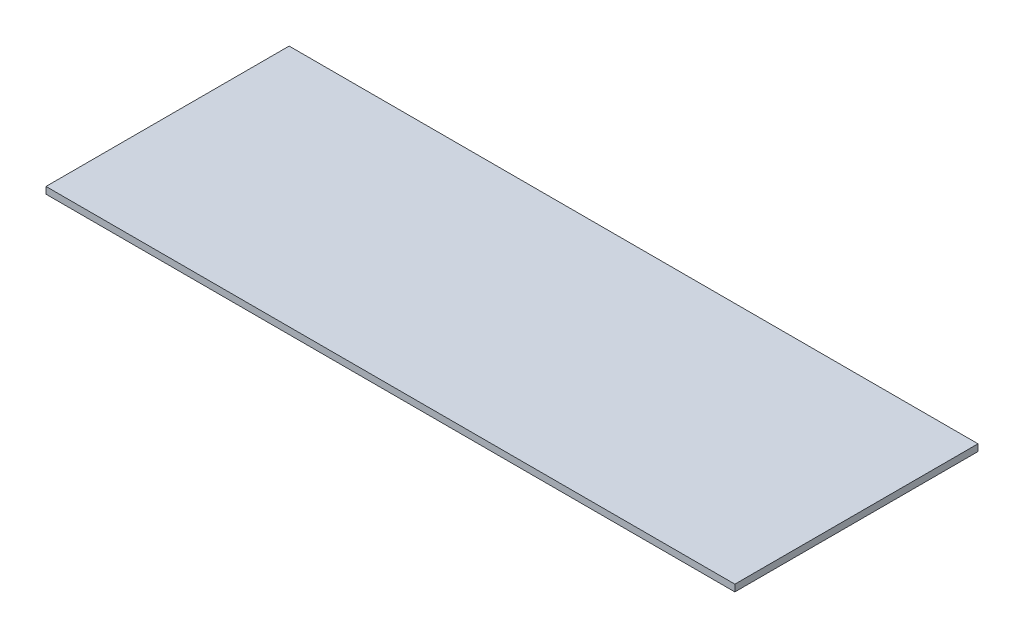
from build123d import *

# Parameters (mm, degrees)
SKETCH1_W           = 647.7
SKETCH1_H           = 228.6
BOSS_EXTRUDE1_DEPTH = 6.35


with BuildPart() as part:
    # Sketch1 → Boss-Extrude1 (new body)
    with BuildSketch(Plane(origin=(0, 0, 0), x_dir=(1, 0, 0), z_dir=(0, 1, 0))):
        Rectangle(SKETCH1_W, SKETCH1_H)
    extrude(amount=BOSS_EXTRUDE1_DEPTH)


solid = part.part
